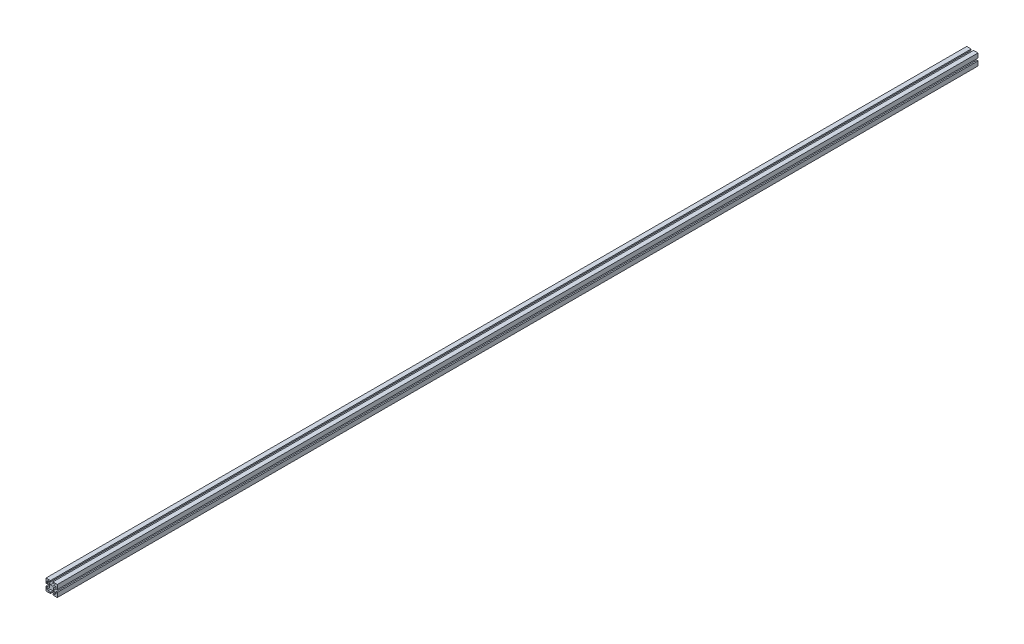
from build123d import *

# Parameters (mm, degrees)
BOSS_EXTRUDE1_DEPTH = 3100.3875


with BuildPart() as part:
    # Sketch2 → Boss-Extrude1 (new body)
    with BuildSketch(Plane(origin=(0.594697292, -0.594697292, 0), x_dir=(1, 0, 0), z_dir=(0, 0, 1))):
        Polygon((-19.644697292, 19.644697292), (-4.658697292, 19.644697292), (-4.658697292, 15.580697292), (-12.707015333, 15.580697292), (-4.477415333, 7.351097292), (3.288020749, 7.351097292), (11.517620749, 15.580697292), (3.469302708, 15.580697292), (3.469302708, 19.644697292), (18.455302708, 19.644697292), (18.455302708, 4.658697292), (14.391302708, 4.658697292), (14.391302708, 12.707015333), (6.161702708, 4.477415333), (6.161702708, -3.288020749), (14.391302708, -11.517620749), (14.391302708, -3.469302708), (18.455302708, -3.469302708), (18.455302708, -18.455302708), (3.469302708, -18.455302708), (3.469302708, -14.391302708), (11.517620749, -14.391302708), (3.288020749, -6.161702708), (-4.477415333, -6.161702708), (-12.707015333, -14.391302708), (-4.658697292, -14.391302708), (-4.658697292, -18.455302708), (-19.644697292, -18.455302708), (-19.644697292, -3.469302708), (-15.580697292, -3.469302708), (-15.580697292, -11.517620749), (-7.351097292, -3.288020749), (-7.351097292, 4.477415333), (-15.580697292, 12.707015333), (-15.580697292, 4.658697292), (-19.644697292, 4.658697292), align=None)
    extrude(amount=BOSS_EXTRUDE1_DEPTH)


solid = part.part
